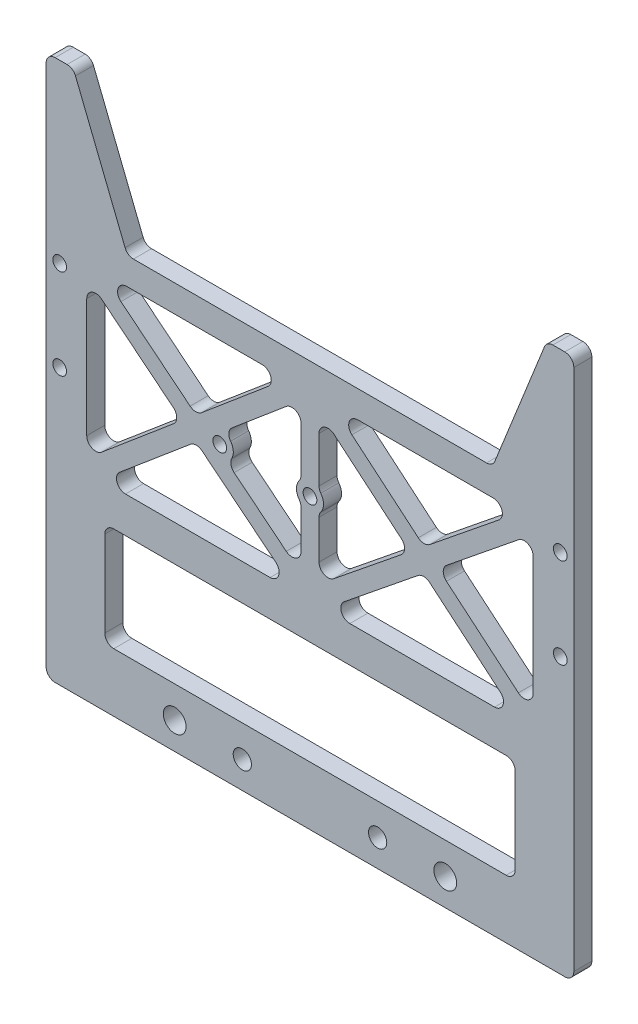
from build123d import *

# Parameters (mm, degrees)
SKETCH_1_W           = 117
SKETCH_1_H           = 120
EXTRUDE_1_DEPTH      = 4
SKETCH_4_W           = 91
SKETCH_4_H           = 23
CUT_EXTRUDE_3_DEPTH  = 10
CUT_EXTRUDE_4_DEPTH  = 10
SKETCH_6_R           = 1.525
CUT_EXTRUDE_5_DEPTH  = 4
SKETCH_8_R           = 2.525
CUT_EXTRUDE_7_DEPTH  = 40
FILLET_1_R           = 2
CUT_EXTRUDE_10_DEPTH = 4
EXTRUDE_4_DEPTH      = 4
FILLET_4_R           = 2
SKETCH_18_R          = 3
EXTRUDE_6_DEPTH      = 4
SKETCH_19_R          = 1.525
CUT_EXTRUDE_12_DEPTH = 4
EXTRUDE_START        = -4
SKETCH_20_R          = 3
SKETCH_20_R_2        = 1.525
EXTRUDE_7_DEPTH      = 4
FILLET_6_R           = 2
SKETCH_21_R          = 2.025
CUT_EXTRUDE_13_DEPTH = 10


with BuildPart() as part:
    # 草图1 → 凸台-拉伸1 (new body)
    with BuildSketch(Plane.XY):
        Rectangle(SKETCH_1_W, SKETCH_1_H)
    extrude(amount=EXTRUDE_1_DEPTH)

    # 草图4 → 切除-拉伸3 (cut)
    with BuildSketch(Plane(origin=(0, 0, 0), x_dir=(-1, 0, 0), z_dir=(0, 0, -1))):
        with Locations((0, -35.5)):
            Rectangle(SKETCH_4_W, SKETCH_4_H)
    extrude(amount=-CUT_EXTRUDE_3_DEPTH, mode=Mode.SUBTRACT)

    # 草图5 → 切除-拉伸4 (cut)
    with BuildSketch(Plane.XY.offset(4)):
        Polygon((-52.5, 60), (-40.5, 30), (40.5, 30), (52.5, 60), align=None)
    extrude(amount=-CUT_EXTRUDE_4_DEPTH, mode=Mode.SUBTRACT)

    # 草图6 → 切除-拉伸5 (cut)
    with BuildSketch(Plane(origin=(0, 0, 0), x_dir=(-1, 0, 0), z_dir=(0, 0, -1))):
        with Locations((-55.5, 21)):
            Circle(SKETCH_6_R)
        with Locations((-55.5, 1)):
            Circle(SKETCH_6_R)
    cut_extrude_5 = extrude(amount=-CUT_EXTRUDE_5_DEPTH, mode=Mode.SUBTRACT)

    # 镜向1: 切除-拉伸5 across plane
    add(cut_extrude_5.mirror(Plane(origin=(0, 0, 0), x_dir=(0, 0, 1), z_dir=(1, 0, 0))), mode=Mode.SUBTRACT)

    # 草图8 → 切除-拉伸7 (cut)
    with BuildSketch(Plane(origin=(0, 0, 0), x_dir=(-1, 0, 0), z_dir=(0, 0, -1))):
        with Locations((30, -54)):
            Circle(SKETCH_8_R)
        with Locations((-30, -54)):
            Circle(SKETCH_8_R)
    extrude(amount=-CUT_EXTRUDE_7_DEPTH, mode=Mode.SUBTRACT)

    # 圆角1
    fillet_1_edges = [part.edges().sort_by_distance(p)[0] for p in [
        (-45.5, -47, 2),
        (45.5, -47, 2),
        (45.5, -24, 2),
        (-45.5, -24, 2),
        (-52.5, 60, 2),
        (52.5, 60, 2),
        (40.5, 30, 2),
        (-40.5, 30, 2),
        (58.5, -60, 2),
        (-58.5, -60, 2),
        (-58.5, 60, 2),
        (58.5, 60, 2),
    ]]
    fillet(fillet_1_edges, radius=FILLET_1_R)

    # 草图12 → 切除-拉伸10 (cut)
    with BuildSketch(Plane(origin=(0, 0, 0), x_dir=(-1, 0, 0), z_dir=(0, 0, -1))):
        Polygon((49.5, 21.428623254), (3.182078723, -16), (49.5, -16), align=None)
        Polygon((2, 24), (2, -11.812461638), (46.317921277, 24), align=None)
        Polygon((-46.317921277, 24), (-2, -11.812461638), (-2, 24), align=None)
        Polygon((-49.5, -16), (-3.182078723, -16), (-49.5, 21.428623254), align=None)
    extrude(amount=-CUT_EXTRUDE_10_DEPTH, mode=Mode.SUBTRACT)

    # 草图15 → 凸台-拉伸4 (add)
    with BuildSketch(Plane.XY.offset(4)):
        Polygon((-3.288271492, 25.529822396), (-50.788271492, -14.470177604), (-48.211728508, -17.529822396), (-0.711728508, 22.470177604), align=None)
        Polygon((0.711728508, 22.470177604), (48.211728508, -17.529822396), (50.788271492, -14.470177604), (3.288271492, 25.529822396), align=None)
    extrude(amount=-EXTRUDE_4_DEPTH)

    # 圆角4
    fillet_4_edges = [part.edges().sort_by_distance(p)[0] for p in [
        (-2, -11.812461638, 2),
        (-46.317921277, 24, 2),
        (46.317921277, 24, 2),
        (2, -11.812461638, 2),
        (3.182078723, -16, 2),
        (49.5, 21.428623254, 2),
        (-3.182078723, -16, 2),
        (-49.5, 21.428623254, 2),
        (-22.117597413, 4.444182736, 2),
        (-25.286552291, 7.004954355, 2),
        (-28.403021143, 4.380559532, 2),
        (-5.104935587, 24, 2),
        (-25.234066266, 1.819787913, 2),
        (-2, 21.3853174, 2),
        (-49.5, -13.3853174, 2),
        (-46.395064413, -16, 2),
        (25.286552291, 7.004954355, 2),
        (22.117597413, 4.444182736, 2),
        (25.234066266, 1.819787913, 2),
        (2, 21.3853174, 2),
        (5.104935587, 24, 2),
        (46.395064413, -16, 2),
        (49.5, -13.3853174, 2),
        (28.403021143, 4.380559532, 2),
    ]]
    fillet(fillet_4_edges, radius=FILLET_4_R)

    # 草图18 → 凸台-拉伸6 (add)
    with BuildSketch(Plane(origin=(0, 0, 0), x_dir=(-1, 0, 0), z_dir=(0, 0, -1))):
        with Locations((20, 4)):
            Circle(SKETCH_18_R)
    extrude(amount=-EXTRUDE_6_DEPTH)

    # 草图19 → 切除-拉伸12 (cut)
    with BuildSketch(Plane.XY.offset(4)):
        with Locations((0, 4)):
            Circle(SKETCH_19_R)
        with Locations((-20, 4)):
            Circle(SKETCH_19_R)
    extrude(amount=-CUT_EXTRUDE_12_DEPTH, mode=Mode.SUBTRACT)

    # 草图20 → 凸台-拉伸7 (add)
    with BuildSketch(Plane(origin=(0, 0, 0), x_dir=(-1, 0, 0), z_dir=(0, 0, -1)).offset(EXTRUDE_START)):
        with Locations((0, 4)):
            Circle(SKETCH_20_R)
        with Locations(Location((0, 4, 0), (0, 0, 180))):
            Circle(SKETCH_20_R_2, mode=Mode.SUBTRACT)
    extrude(amount=EXTRUDE_7_DEPTH)

    # 圆角6
    fillet_6_edges = [part.edges().sort_by_distance(p)[0] for p in [
        (-19.208718836, 6.893764697, 2),
        (-18.415492277, 1.452582626, 2),
        (-2, 6.236067977, 2),
        (-2, 1.763932023, 2),
        (2, 1.763932023, 2),
        (2, 6.236067977, 2),
    ]]
    fillet(fillet_6_edges, radius=FILLET_6_R)

    # 草图21 → 切除-拉伸13 (cut)
    with BuildSketch(Plane.XY.offset(4)):
        with Locations((-15, -54)):
            Circle(SKETCH_21_R)
        with Locations((15, -54)):
            Circle(SKETCH_21_R)
    extrude(amount=-CUT_EXTRUDE_13_DEPTH, mode=Mode.SUBTRACT)


solid = part.part
